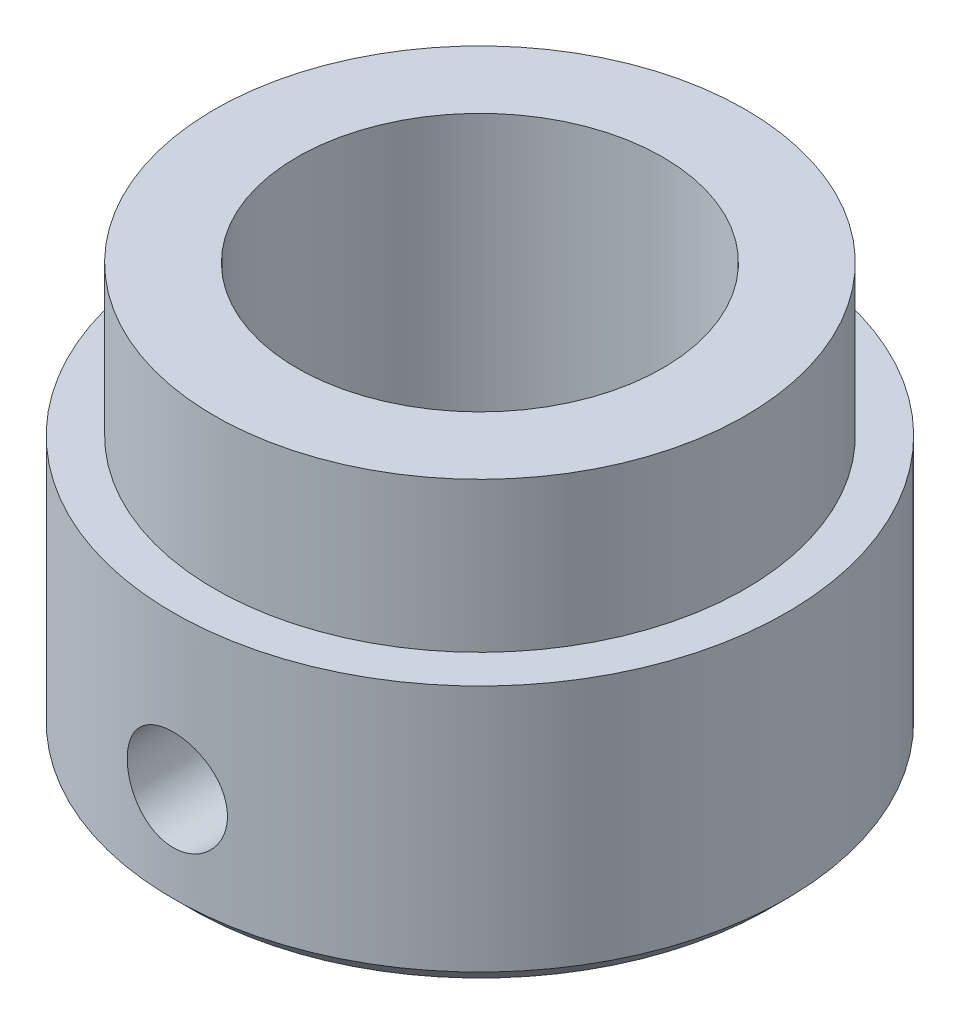
from build123d import *

# Parameters (mm, degrees)
CORTE_EXTRUS_O1_DEPTH      = 51.902259282
CORTE_EXTRUS_O1_DEPTH_BACK = 51.902259282
ESBO_O2_R                  = 4.25


with BuildPart() as part:
    # Esboço1 → Revolução1 (revolve)
    with BuildSketch(Plane(origin=(0, 0, 0), x_dir=(0, 0, -1), z_dir=(1, 0, 0))):
        Polygon((15.5, 35.2), (15.5, 0), (24.5, 0), (26, 1.5), (26, 22.5), (22.5, 22.5), (22.5, 35.2), align=None)
    revolve(axis=Axis((0, 0, 0), (0, 1, 0)))

    # Esboço2 → Corte-extrusão1 (cut, two sides: drawn at the far end of the back side and taken through both)
    with BuildSketch(Plane.XY.offset(-CORTE_EXTRUS_O1_DEPTH_BACK)):
        with Locations((0, 9.5)):
            Circle(ESBO_O2_R)
    extrude(amount=CORTE_EXTRUS_O1_DEPTH + CORTE_EXTRUS_O1_DEPTH_BACK, mode=Mode.SUBTRACT)


solid = part.part
